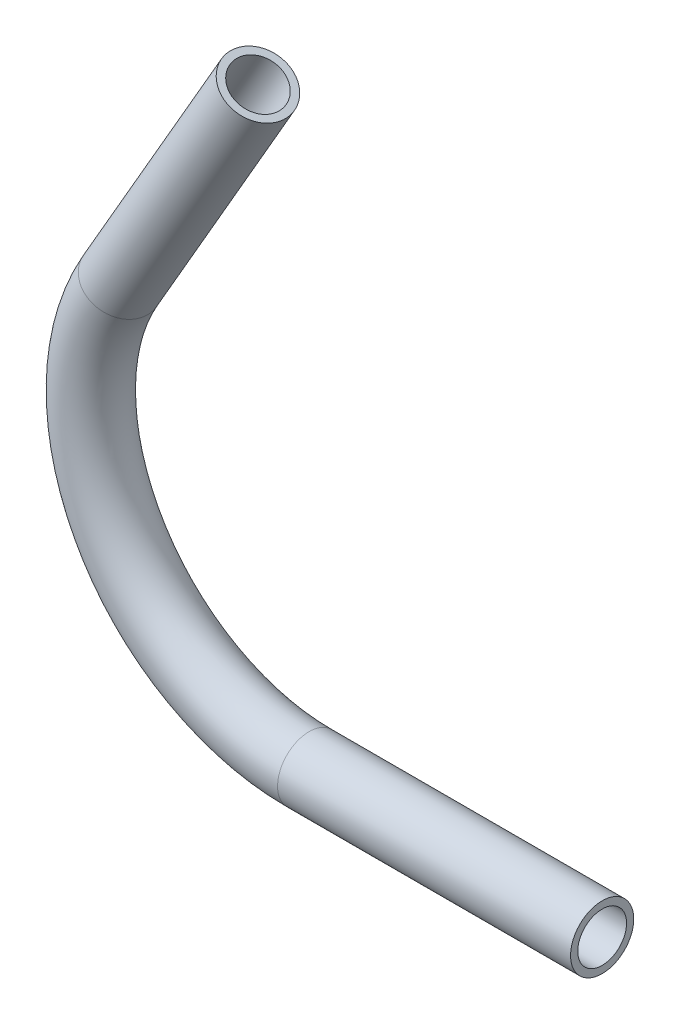
from build123d import *

# Parameters (mm, degrees)
ESQUISSE2_R        = 11
ESQUISSE2_R_2      = 8.5
ESQUISSE3_R        = 11
ESQUISSE3_R_2      = 8.5
BOSS_EXTRU_1_DEPTH = 102
ESQUISSE4_R        = 11
ESQUISSE4_R_2      = 8.5
BOSS_EXTRU_2_DEPTH = 96


with BuildPart() as part:
    # Base-Balayage: sweep along a path in Esquisse1
    with BuildLine(Plane.XY) as base_balayage_path:
        ThreePointArc((-65.817930688, 38), (-65.817930688, -38), (0, -76))
    # Esquisse2 → Base-Balayage (sweep)
    with BuildSketch(Plane(origin=(0, 0, 0), x_dir=(0, 0, -1), z_dir=(1, 0, 0))):
        with Locations((0, -76)):
            Circle(ESQUISSE2_R)
        with Locations((0, -76)):
            Circle(ESQUISSE2_R_2, mode=Mode.SUBTRACT)
    sweep(path=base_balayage_path.line)

    # Esquisse3 → Boss.-Extru.1 (add)
    with BuildSketch(Plane(origin=(0, 0, 0), x_dir=(0, 0, -1), z_dir=(1, 0, 0))):
        with Locations(Location((0, -76, 0), (0, 0, 270))):
            Circle(ESQUISSE3_R)
        with Locations(Location((0, -76, 0), (0, 0, 270))):
            Circle(ESQUISSE3_R_2, mode=Mode.SUBTRACT)
    extrude(amount=BOSS_EXTRU_1_DEPTH)

    # Esquisse4 → Boss.-Extru.2 (add)
    with BuildSketch(Plane(origin=(0, 0, 0), x_dir=(-0.8660254037844417, 0.4999999999999947, 0), z_dir=(0.49999999999999484, 0.8660254037844418, 0))):
        with Locations((76, 0)):
            Circle(ESQUISSE4_R)
        with Locations((76, 0)):
            Circle(ESQUISSE4_R_2, mode=Mode.SUBTRACT)
    extrude(amount=BOSS_EXTRU_2_DEPTH)


solid = part.part
